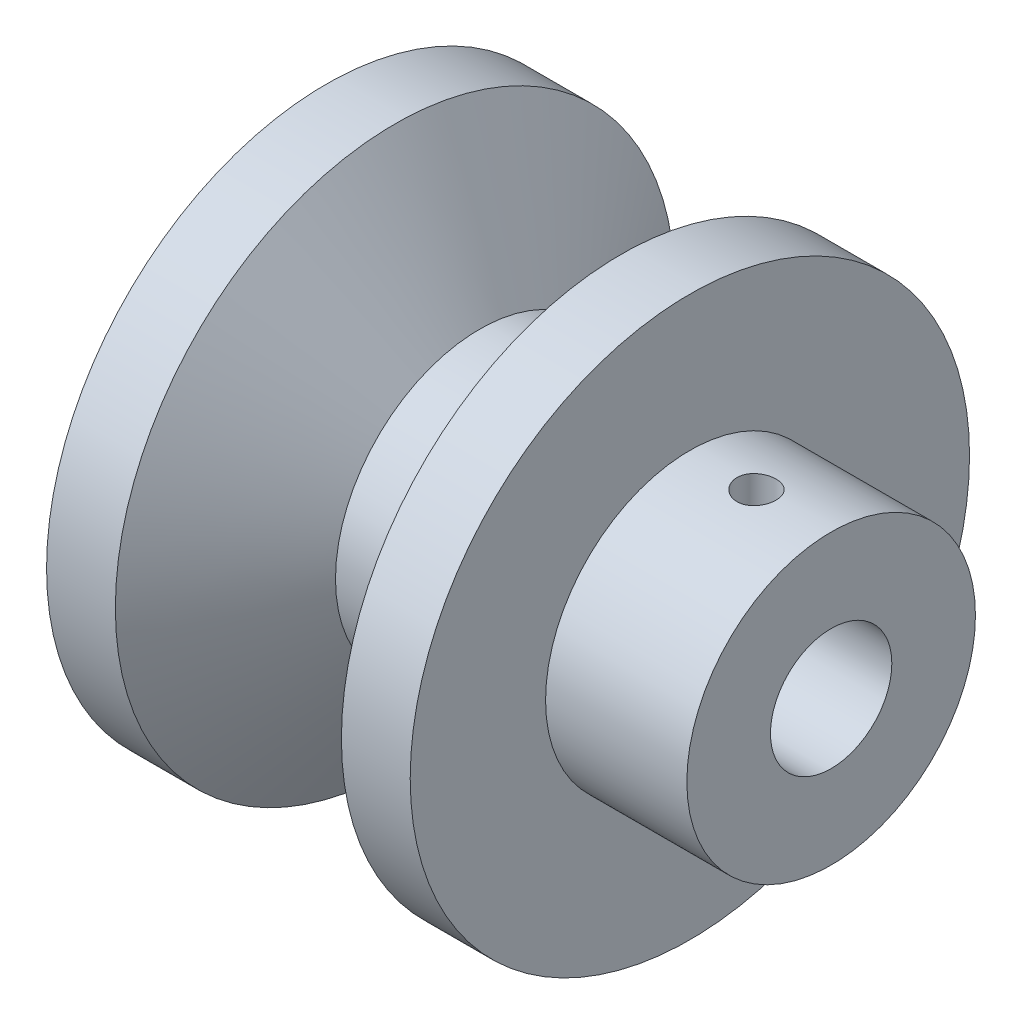
from build123d import *

# Parameters (mm, degrees)
SKETCH_2_R          = 1.385
CUT_EXTRUDE_1_DEPTH = 10
SKETCH_3_R          = 4.295
CUT_EXTRUDE_2_DEPTH = 10
SKETCH_4_W          = 5.34454344
SKETCH_4_H          = 1.293128569
EXTRUDE_1_DEPTH     = 7
SKETCH_6_R          = 1.385
CUT_EXTRUDE_3_DEPTH = 7


with BuildPart() as part:
    # 草圖1 → 旋轉1 (revolve)
    with BuildSketch(Plane.XY, mode=Mode.PRIVATE) as revolve_1_sk:
        Polygon((0, 0), (0, 19.795), (4.87, 19.795), (10.87, 10.213858447), (14.87, 10.213858447), (20.87, 19.795), (25.74, 19.795), (25.74, 10.213858447), (35.74, 10.213858447), (35.74, 0), align=None)
    revolve(revolve_1_sk.sketch.rotate(Axis((-743.15639781, 0, 0), (1, 0, 0)), 90), axis=Axis((-743.15639781, 0, 0), (1, 0, 0)))

    # 草圖2 → 除料-伸長1 (cut)
    with BuildSketch(Plane(origin=(0, 12, 0), x_dir=(1, 0, 0), z_dir=(0, 1, 0))):
        with Locations(Location((30.456485429, 0, 0), (0, 0, 270))):
            Circle(SKETCH_2_R)
    extrude(amount=-CUT_EXTRUDE_1_DEPTH, mode=Mode.SUBTRACT)

    # 草圖3 → 除料-伸長2 (cut)
    with BuildSketch(Plane(origin=(35.74, 0, 0), x_dir=(0, 0, -1), z_dir=(1, 0, 0))):
        Circle(SKETCH_3_R)
    extrude(amount=-CUT_EXTRUDE_2_DEPTH, mode=Mode.SUBTRACT)

    # 草圖4 → 填料-伸長1 (add)
    with BuildSketch(Plane(origin=(25.74, 0, 0), x_dir=(0, 0, -1), z_dir=(1, 0, 0))):
        with Locations((-0.084600543, 4.07453495)):
            Rectangle(SKETCH_4_W, SKETCH_4_H)
    extrude(amount=EXTRUDE_1_DEPTH)

    # 草圖6 → 除料-伸長3 (cut)
    with BuildSketch(Plane(origin=(0, 4.721099234, 0), x_dir=(1, 0, 0), z_dir=(0, 1, 0))):
        with Locations(Location((30.456485429, 0, 0), (0, 0, 270))):
            Circle(SKETCH_6_R)
    extrude(amount=-CUT_EXTRUDE_3_DEPTH, mode=Mode.SUBTRACT)


solid = part.part
